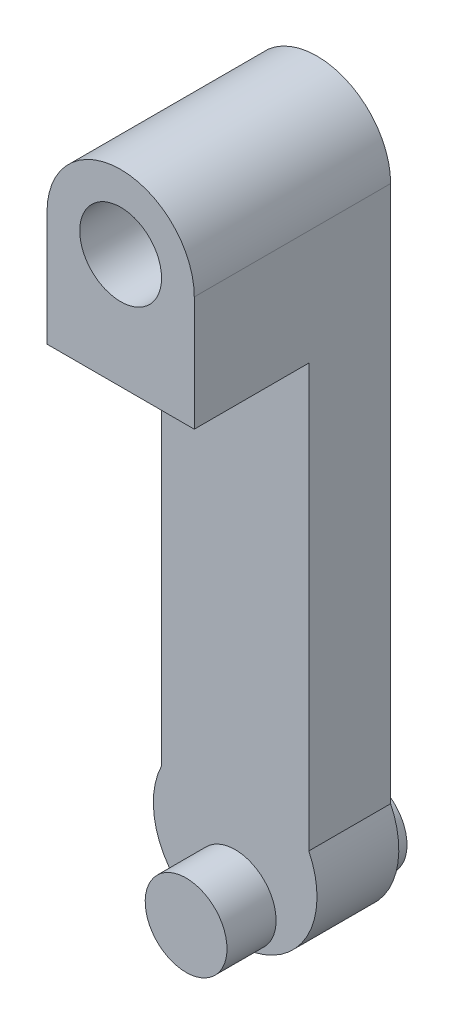
from build123d import *

# Parameters (mm, degrees)
SKETCH1_R           = 3.175
BOSS_EXTRUDE1_DEPTH = 6.35
SKETCH2_R           = 3.175
BOSS_EXTRUDE2_DEPTH = 3.81
BOSS_EXTRUDE3_START = -10.16
SKETCH2_2_R         = 3.175
BOSS_EXTRUDE3_DEPTH = 3.81
SKETCH4_R           = 3.175
BOSS_EXTRUDE4_DEPTH = 8.89


with BuildPart() as part:
    # Sketch1 → Boss-Extrude1 (new body)
    with BuildSketch(Plane.XY):
        with BuildLine():
            Line((-5.715, 0), (-5.715, -41.682099171))
            ThreePointArc((-5.715, -41.682099171), (0, -50.8), (5.715, -41.682099171))
            Line((5.715, -41.682099171), (5.715, 0))
            ThreePointArc((5.715, 0), (0, 5.715), (-5.715, 0))
        make_face()
        Circle(SKETCH1_R, mode=Mode.SUBTRACT)
    extrude(amount=BOSS_EXTRUDE1_DEPTH)

    # Sketch2 → Boss-Extrude2 (add)
    with BuildSketch(Plane.XY.offset(6.35)):
        with Locations(Location((0, -47.625, 0), (0, 0, 269.999356937))):
            Circle(SKETCH2_R)
    extrude(amount=BOSS_EXTRUDE2_DEPTH)

    # Sketch2<2> → Boss-Extrude3 (add)
    with BuildSketch(Plane.XY.offset(6.35).offset(BOSS_EXTRUDE3_START)):
        with Locations(Location((0, -47.625, 0), (0, 0, 269.999356937))):
            Circle(SKETCH2_2_R)
    extrude(amount=BOSS_EXTRUDE3_DEPTH)

    # Sketch4 → Boss-Extrude4 (add)
    with BuildSketch(Plane.XY.offset(6.35)):
        with BuildLine():
            Line((-5.715, -8.89), (5.715, -8.89))
            Line((5.715, -8.89), (5.715, 0))
            ThreePointArc((5.715, 0), (0, 5.715), (-5.715, 0))
            Line((-5.715, 0), (-5.715, -8.89))
        make_face()
        Circle(SKETCH4_R, mode=Mode.SUBTRACT)
    extrude(amount=BOSS_EXTRUDE4_DEPTH)


solid = part.part
